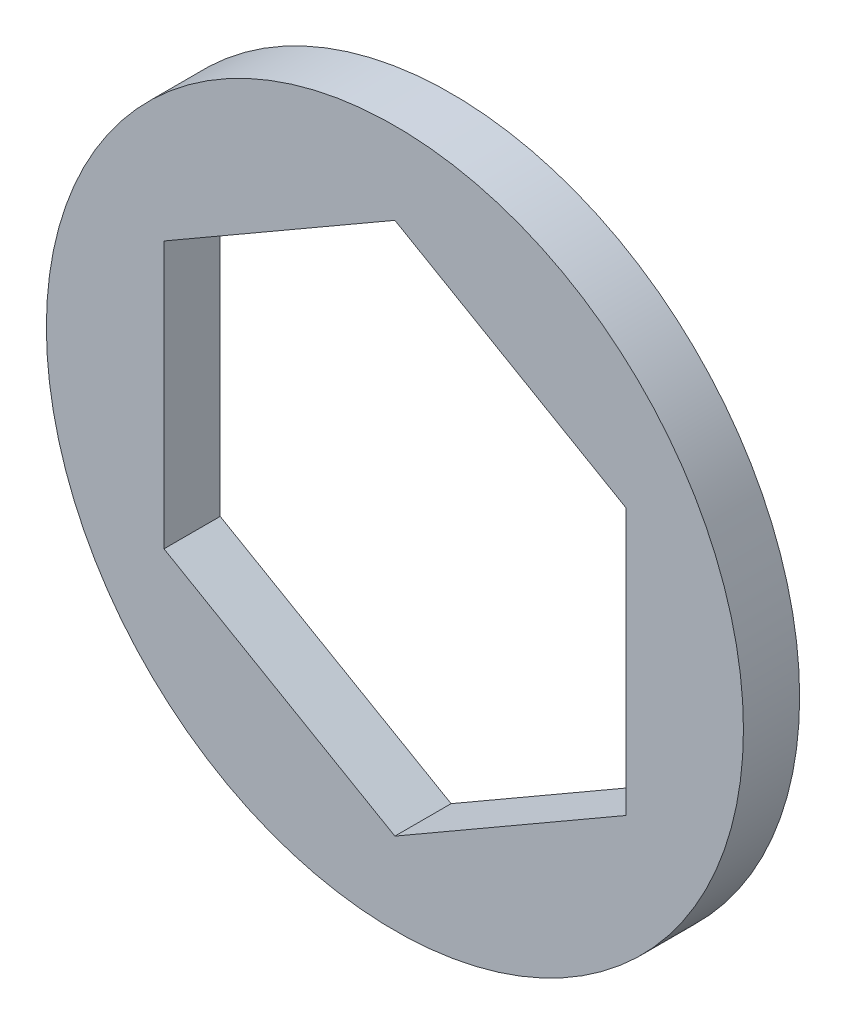
from build123d import *

# Parameters (mm, degrees)
SKETCH1_R           = 10.16
BOSS_EXTRUDE1_DEPTH = 0.81915


with BuildPart() as part:
    # Sketch1 → Boss-Extrude1 (new, symmetric)
    with BuildSketch(Plane.XY):
        with Locations(Location((0, 0, 0), (0, 0, 180))):
            Circle(SKETCH1_R)
        Polygon((0, 7.772289324), (-6.731, 3.886144662), (-6.731, -3.886144662), (0, -7.772289324), (6.731, -3.886144662), (6.731, 3.886144662), align=None, mode=Mode.SUBTRACT)
    extrude(amount=BOSS_EXTRUDE1_DEPTH, both=True)


solid = part.part
